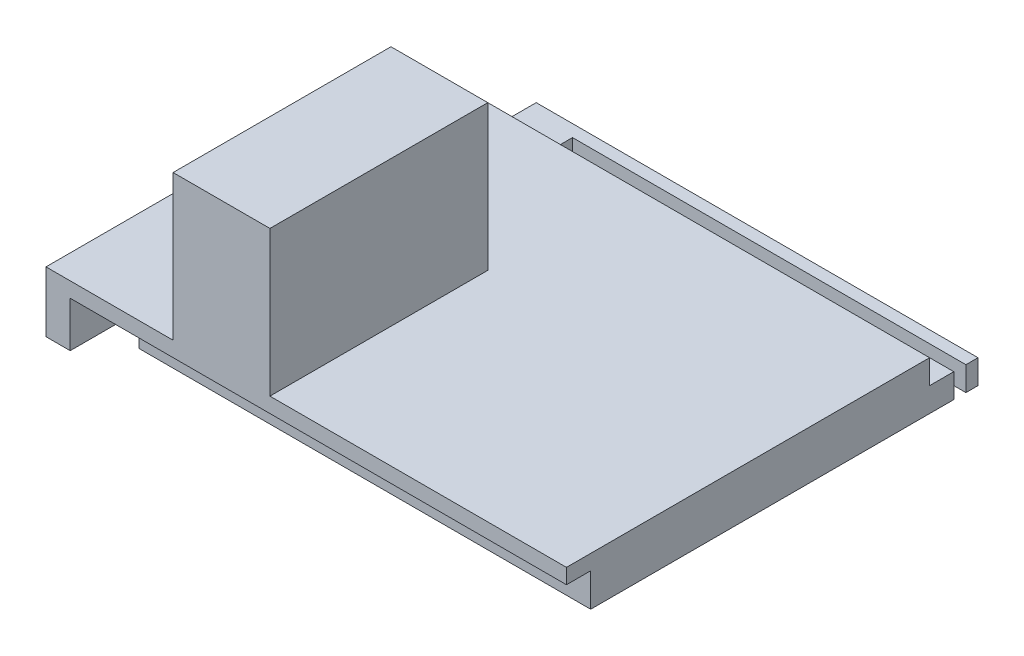
from build123d import *

# Parameters (mm, degrees)
SKETCH_1_W                      = 53
SKETCH_1_H                      = 32
EXTRUDE_1_DEPTH                 = 2
SKETCH_1_5_W                    = 0.8
SKETCH_1_5_H                    = 32
EXTRUDE_3_DEPTH                 = 0.8
SKETCH_1_6_W                    = 0.8
SKETCH_1_6_H                    = 32
EXTRUDE_4_DEPTH                 = 0.8
SKETCH_3_W                      = 54.6
SKETCH_3_H                      = 1
EXTRUDE_5_DEPTH                 = 0.8
SKETCH_4_W                      = 45
SKETCH_4_H                      = 1
CUT_EXTRUDE_1_DEPTH             = 33.222507662
SKETCH_4_2_W                    = 45
SKETCH_4_2_H                    = 1
EXTRUDE_6_DEPTH                 = 2
SKETCH_5_W                      = 45
SKETCH_5_H                      = 1
CUT_EXTRUDE_2_DEPTH             = 2
SKETCH_6_W                      = 0.8
SKETCH_6_H                      = 1
CUT_EXTRUDE_3_DEPTH             = 10
EXTRUDE_7_DEPTH                 = 18
EXTRUDE_7_DEPTH_BACK            = 12
EXTRUDE_8_DEPTH                 = 18
EXTRUDE_8_DEPTH_BACK            = 12
SKETCH_8_W                      = 49
SKETCH_8_H                      = 2
CUT_EXTRUDE_4_REACH             = 39.802
SKETCH_12_W                     = 2
SKETCH_12_H                     = 0.755050506
CUT_EXTRUDE_4_DIRECTION_2_REACH = 39.802
CUT_EXTRUDE_5_REACH             = 48.787
SKETCH_9_W                      = 48.171487548
SKETCH_9_H                      = 25.213726265
CUT_EXTRUDE_6_REACH             = 48.787
SKETCH_13_W                     = 1
SKETCH_13_H                     = 0.8
SKETCH_14_W                     = 8
SKETCH_14_H                     = 12
EXTRUDE_9_DEPTH                 = 18


with BuildPart() as part:
    # 草图1 → 凸台-拉伸1 (new body)
    with BuildSketch(Plane(origin=(0, 0, 0), x_dir=(1, 0, 0), z_dir=(0, 1, 0))):
        Rectangle(SKETCH_1_W, SKETCH_1_H)
    extrude(amount=EXTRUDE_1_DEPTH)

    # 草图1<5> → 凸台-拉伸3 (add)
    with BuildSketch(Plane(origin=(0, 0, 0), x_dir=(1, 0, 0), z_dir=(0, 1, 0))):
        with Locations((-26.9, 0)):
            Rectangle(SKETCH_1_5_W, SKETCH_1_5_H)
    extrude(amount=EXTRUDE_3_DEPTH)

    # 草图1<6> → 凸台-拉伸4 (add)
    with BuildSketch(Plane(origin=(0, 0, 0), x_dir=(1, 0, 0), z_dir=(0, 1, 0))):
        with Locations((26.9, 0)):
            Rectangle(SKETCH_1_6_W, SKETCH_1_6_H)
    extrude(amount=EXTRUDE_4_DEPTH)

    # 草图3 → 凸台-拉伸5 (add)
    with BuildSketch(Plane(origin=(0, 0, 0), x_dir=(1, 0, 0), z_dir=(0, 1, 0))):
        with Locations((0, -16.5)):
            Rectangle(SKETCH_3_W, SKETCH_3_H)
    extrude(amount=EXTRUDE_5_DEPTH)

    # 草图4 → 切除-拉伸1 (cut, through all)
    with BuildSketch(Plane(origin=(0, 0, 0), x_dir=(1, 0, 0), z_dir=(0, 1, 0))):
        with Locations((0, -14.5)):
            Rectangle(SKETCH_4_W, SKETCH_4_H)
    extrude(amount=CUT_EXTRUDE_1_DEPTH, mode=Mode.SUBTRACT)

    # 草图4<2> → 凸台-拉伸6 (add)
    with BuildSketch(Plane(origin=(0, 0, 0), x_dir=(1, 0, 0), z_dir=(0, 1, 0))):
        with Locations((0, -14.5)):
            Rectangle(SKETCH_4_2_W, SKETCH_4_2_H)
    extrude(amount=EXTRUDE_6_DEPTH)

    # 草图5 → 切除-拉伸2 (cut)
    with BuildSketch(Plane(origin=(0, 0, 0), x_dir=(1, 0, 0), z_dir=(0, 1, 0))):
        with Locations((0, 14.5)):
            Rectangle(SKETCH_5_W, SKETCH_5_H)
    extrude(amount=CUT_EXTRUDE_2_DEPTH, mode=Mode.SUBTRACT)

    # 草图6 → 切除-拉伸3 (cut)
    with BuildSketch(Plane(origin=(0, 0, 0), x_dir=(1, 0, 0), z_dir=(0, 1, 0))):
        with Locations((-26.9, -16.5)):
            Rectangle(SKETCH_6_W, SKETCH_6_H)
        with Locations((26.9, -16.5)):
            Rectangle(SKETCH_6_W, SKETCH_6_H)
    extrude(amount=CUT_EXTRUDE_3_DEPTH, mode=Mode.SUBTRACT)

    # 草图7 → 凸台-拉伸7 (add, two sides: drawn at the far end of the back side and taken through both)
    with BuildSketch(Plane.XY.offset(-EXTRUDE_7_DEPTH_BACK)):
        Polygon((-24.5, 2), (-24.5, 4), (-33, 4), (-33, -1), (-31, -1), (-31, 2), align=None)
        Polygon((24.5, 2), (24.5, 4), (33, 4), (33, -1), (31, -1), (31, 2), align=None)
    extrude(amount=EXTRUDE_7_DEPTH + EXTRUDE_7_DEPTH_BACK)

    # 草图8 → 凸台-拉伸8 (add, two sides: drawn at the far end of the back side and taken through both)
    with BuildSketch(Plane.XY.offset(-EXTRUDE_8_DEPTH_BACK)):
        with Locations((0, 3)):
            Rectangle(SKETCH_8_W, SKETCH_8_H)
    extrude(amount=EXTRUDE_8_DEPTH + EXTRUDE_8_DEPTH_BACK)

    # 切除-拉伸4: up to this face of the body (flat: up to its plane)
    cut_extrude_4_end = Plane(part.part.faces().sort_by_distance((-31, 0.5, 3))[0])
    # 草图12 → 切除-拉伸4 (cut, up to the picked face)
    with BuildSketch(Plane(origin=(0, 0, 0), x_dir=(0, 0, -1), z_dir=(1, 0, 0)), mode=Mode.PRIVATE) as cut_extrude_4_sk1:
        with Locations((-17, 2.377525253)):
            Rectangle(SKETCH_12_W, SKETCH_12_H)
    cut_extrude_4_tool1 = split(extrude(cut_extrude_4_sk1.sketch, amount=-CUT_EXTRUDE_4_REACH, mode=Mode.PRIVATE), bisect_by=cut_extrude_4_end, keep=Keep.BOTH, mode=Mode.PRIVATE)
    add(cut_extrude_4_tool1.solids().sort_by(Axis((0, 2.377525, 17), (-1, 0, 0)))[0], mode=Mode.SUBTRACT)

    # 切除-拉伸4 direction 2: up to this face of the body (flat: up to its plane)
    cut_extrude_4_direction_2_end = Plane(part.part.faces().sort_by_distance((31, 0.5, 3))[0])
    # 草图12 → 切除-拉伸4 direction 2 (cut, up to the picked face)
    with BuildSketch(Plane(origin=(0, 0, 0), x_dir=(0, 0, -1), z_dir=(1, 0, 0)), mode=Mode.PRIVATE) as cut_extrude_4_direction_2_sk1:
        with Locations((-17, 2.377525253)):
            Rectangle(SKETCH_12_W, SKETCH_12_H)
    cut_extrude_4_direction_2_tool1 = split(extrude(cut_extrude_4_direction_2_sk1.sketch, amount=CUT_EXTRUDE_4_DIRECTION_2_REACH, mode=Mode.PRIVATE), bisect_by=cut_extrude_4_direction_2_end, keep=Keep.BOTH, mode=Mode.PRIVATE)
    add(cut_extrude_4_direction_2_tool1.solids().sort_by(Axis((0, 2.377525, 17), (1, 0, 0)))[0], mode=Mode.SUBTRACT)

    # 草图9 → 切除-拉伸5 (cut, up to next)
    with BuildSketch(Plane(origin=(10, 0, 0), x_dir=(0, 0, -1), z_dir=(1, 0, 0)), mode=Mode.PRIVATE) as cut_extrude_5_sk1:
        with Locations((-3.488196671, 1.118476511)):
            Rectangle(SKETCH_9_W, SKETCH_9_H)
    cut_extrude_5_tool1 = extrude(cut_extrude_5_sk1.sketch, amount=CUT_EXTRUDE_5_REACH, mode=Mode.PRIVATE) & part.part
    add(cut_extrude_5_tool1.solids().sort_by_distance((10, 1.118477, 3.488197))[0], mode=Mode.SUBTRACT)

    # 草图13 → 切除-拉伸6 (cut, up to next)
    with BuildSketch(Plane(origin=(10, 0, 0), x_dir=(0, 0, -1), z_dir=(1, 0, 0)), mode=Mode.PRIVATE) as cut_extrude_6_sk1:
        with Locations((-16.5, 0.4)):
            Rectangle(SKETCH_13_W, SKETCH_13_H)
    cut_extrude_6_tool1 = extrude(cut_extrude_6_sk1.sketch, amount=-CUT_EXTRUDE_6_REACH, mode=Mode.PRIVATE) & part.part
    add(cut_extrude_6_tool1.solids().sort_by_distance((10, 0.4, 16.5))[0], mode=Mode.SUBTRACT)

    # 草图14 → 凸台-拉伸9 (add, through all)
    with BuildSketch(Plane.XY):
        with Locations((-18.5, 10)):
            Rectangle(SKETCH_14_W, SKETCH_14_H)
    extrude(amount=EXTRUDE_9_DEPTH)


solid = part.part
